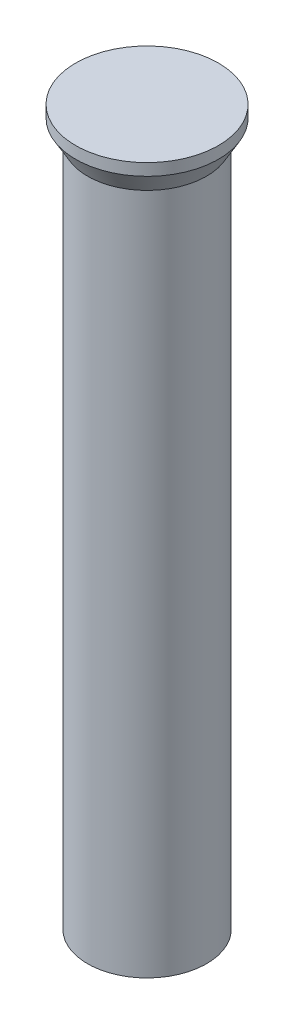
from build123d import *


with BuildPart() as part:
    # Sketch1 → Revolve1 (revolve)
    with BuildSketch(Plane.XY, mode=Mode.PRIVATE) as revolve1_sk:
        Polygon((0, 0), (6, 0), (6, -1), (5, -2.732050808), (5, -60), (0, -60), align=None)
    revolve(revolve1_sk.sketch.rotate(Axis((0, -65, 0), (0, 1, 0)), 90), axis=Axis((0, -65, 0), (0, 1, 0)))


solid = part.part
